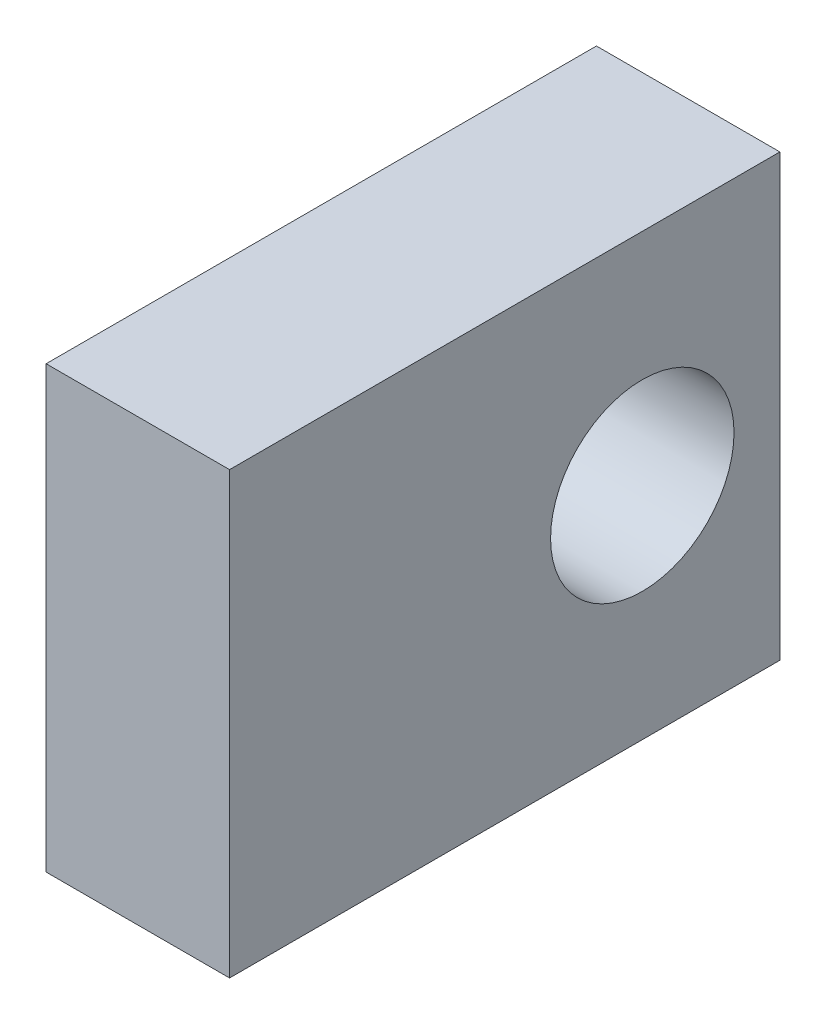
from build123d import *

# Parameters (mm, degrees)
SKETCH1_W           = 38.1
SKETCH1_H           = 30.48
SKETCH1_R           = 6.35
BOSS_EXTRUDE1_DEPTH = 12.7


with BuildPart() as part:
    # Sketch1 → Boss-Extrude1 (new body)
    with BuildSketch(Plane(origin=(0, 0, 0), x_dir=(0, 0, -1), z_dir=(1, 0, 0))):
        Rectangle(SKETCH1_W, SKETCH1_H)
        with Locations((9.525, 0)):
            Circle(SKETCH1_R, mode=Mode.SUBTRACT)
    extrude(amount=BOSS_EXTRUDE1_DEPTH)


solid = part.part
